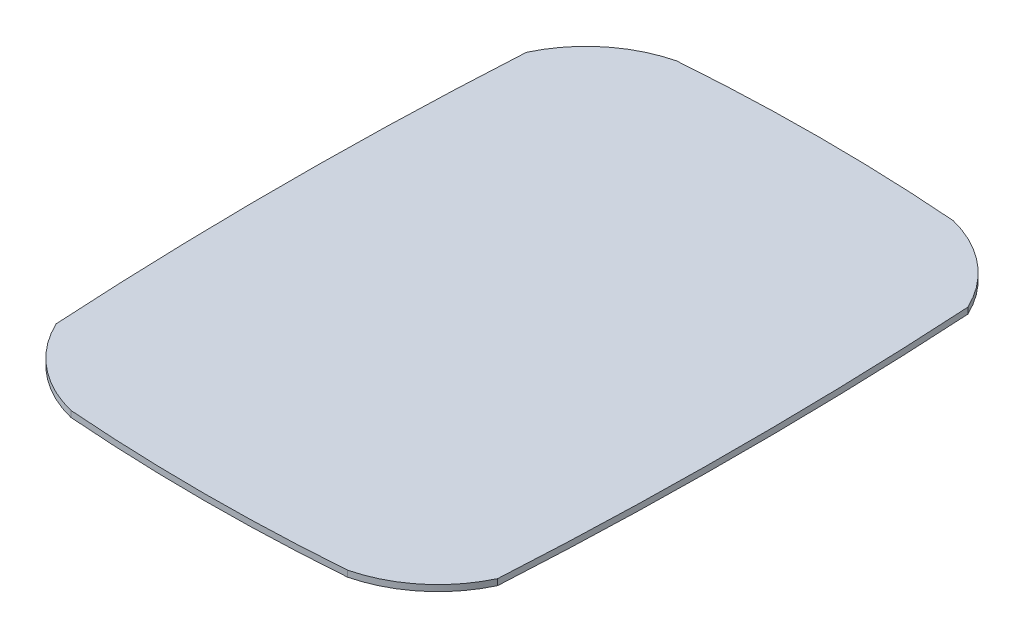
from build123d import *

# Parameters (mm, degrees)
BOSS_EXTRUDE1_DEPTH = 2.54
SKETCH6_W           = 5
SKETCH6_H           = 2.5
CUT_EXTRUDE2_DEPTH  = 0.2


with BuildPart() as part:
    # Sketch3 → Boss-Extrude1 (new body)
    with BuildSketch(Plane(origin=(0, 0, 0), x_dir=(1, 0, 0), z_dir=(0, 1, 0))):
        with BuildLine():
            ThreePointArc((-91.6492325, -96.833825344), (-94.514268143, 0.78027625), (-91.6492325, 98.394377843))
            ThreePointArc((-91.6492325, 98.394377843), (-77.728790436, 116.300836492), (-57.46959223, 126.498133029))
            ThreePointArc((-57.46959223, 126.498133029), (0, 128.705492461), (57.46959223, 126.498133029))
            ThreePointArc((57.46959223, 126.498133029), (77.728790436, 116.300836492), (91.6492325, 98.394377843))
            ThreePointArc((91.6492325, 98.394377843), (94.514268143, 0.78027625), (91.6492325, -96.833825344))
            ThreePointArc((91.6492325, -96.833825344), (77.728790436, -114.740283992), (57.46959223, -124.937580529))
            ThreePointArc((57.46959223, -124.937580529), (0, -127.144939961), (-57.46959223, -124.937580529))
            ThreePointArc((-57.46959223, -124.937580529), (-77.728790436, -114.740283992), (-91.6492325, -96.833825344))
        make_face()
    extrude(amount=BOSS_EXTRUDE1_DEPTH)

    # Sketch6 → Cut-Extrude2 (cut)
    with BuildSketch(Plane.XZ):
        Polygon((-80.884003768, 97.161784557), (-83.675257034, 101.310146306), (-81.601076159, 102.705772939), (-78.809822893, 98.55741119), align=None)
        Polygon((-60.2566864, 111.041014588), (-63.047939666, 115.189376338), (-65.122120541, 113.793749705), (-62.330867275, 109.645387955), align=None)
        Polygon((-67.644809829, 81.963964192), (-69.718990703, 80.568337559), (-72.510243969, 84.716699309), (-70.436063095, 86.112325942), align=None)
        Polygon((-51.16585421, 93.051940957), (-49.091673336, 94.44756759), (-51.882926602, 98.59592934), (-53.957107476, 97.200302707), align=None)
        Polygon((51.882926602, 98.59592934), (53.957107476, 97.200302707), (51.16585421, 93.051940957), (49.091673336, 94.44756759), align=None)
        Polygon((65.122120541, 113.793749705), (62.330867275, 109.645387955), (60.2566864, 111.041014588), (63.047939666, 115.189376338), align=None)
        Polygon((67.644809829, 81.963964192), (69.718990703, 80.568337559), (72.510243969, 84.716699309), (70.436063095, 86.112325942), align=None)
        Polygon((80.884003768, 97.161784557), (83.675257034, 101.310146306), (81.601076159, 102.705772939), (78.809822893, 98.55741119), align=None)
        with Locations((67.276236393, 10.46972375)):
            Rectangle(SKETCH6_W, SKETCH6_H)
        with Locations((87.276236393, 10.46972375)):
            Rectangle(SKETCH6_W, SKETCH6_H)
        with Locations((67.276236393, -12.03027625)):
            Rectangle(SKETCH6_W, SKETCH6_H)
        with Locations((87.276236393, -12.03027625)):
            Rectangle(SKETCH6_W, SKETCH6_H)
        Polygon((72.510243969, -86.277251808), (70.436063095, -87.672878441), (67.644809829, -83.524516692), (69.718990703, -82.128890059), align=None)
        Polygon((81.601076159, -104.266325439), (78.809822893, -100.11796369), (80.884003768, -98.722337057), (83.675257034, -102.870698806), align=None)
        Polygon((60.2566864, -112.601567088), (63.047939666, -116.749928837), (65.122120541, -115.354302204), (62.330867275, -111.205940455), align=None)
        Polygon((51.16585421, -94.612493457), (49.091673336, -96.00812009), (51.882926602, -100.15648184), (53.957107476, -98.760855207), align=None)
        Polygon((-65.122120541, -115.354302204), (-62.330867275, -111.205940455), (-60.2566864, -112.601567088), (-63.047939666, -116.749928837), align=None)
        Polygon((-51.882926602, -100.15648184), (-53.957107476, -98.760855207), (-51.16585421, -94.612493457), (-49.091673336, -96.00812009), align=None)
        Polygon((-80.884003768, -98.722337057), (-83.675257034, -102.870698806), (-81.601076159, -104.266325439), (-78.809822893, -100.11796369), align=None)
        Polygon((-67.644809829, -83.524516692), (-69.718990703, -82.128890059), (-72.510243969, -86.277251808), (-70.436063095, -87.672878441), align=None)
        with Locations((-67.276236393, 10.46972375)):
            Rectangle(SKETCH6_W, SKETCH6_H)
        with Locations((-67.276236393, -12.03027625)):
            Rectangle(SKETCH6_W, SKETCH6_H)
        with Locations((-87.276236393, -12.03027625)):
            Rectangle(SKETCH6_W, SKETCH6_H)
        with Locations((-87.276236393, 10.46972375)):
            Rectangle(SKETCH6_W, SKETCH6_H)
    extrude(amount=-CUT_EXTRUDE2_DEPTH, mode=Mode.SUBTRACT)


solid = part.part
